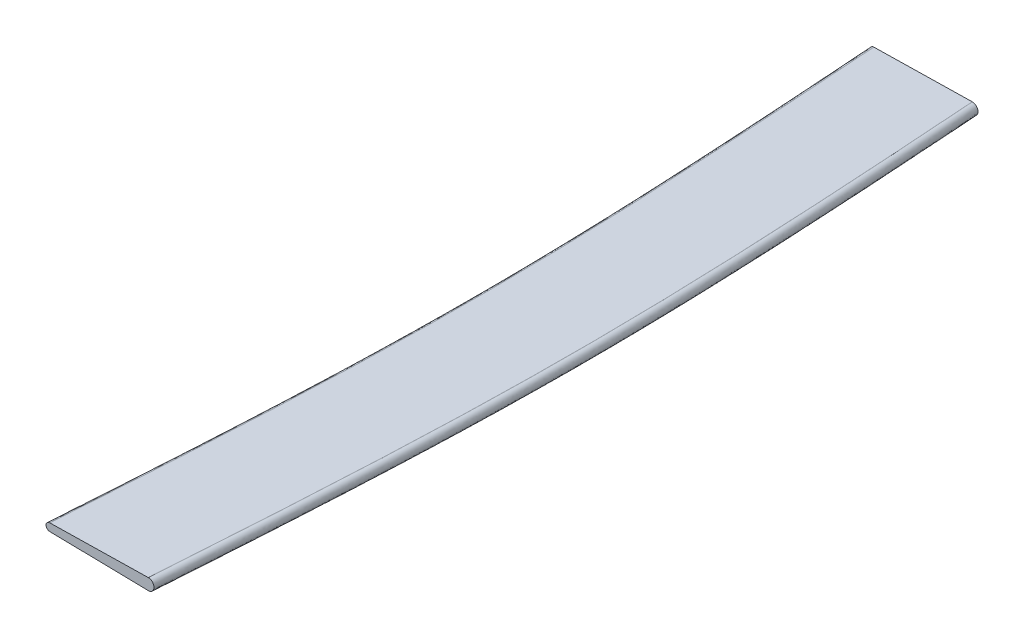
from build123d import *

# Parameters (mm, degrees)
SKETCH3_W          = 147.197168892
SKETCH3_H          = 17.539277342
SKETCH3_W_2        = 144.574061536
SKETCH3_H_2        = 20.253471686
CUT_EXTRUDE1_DEPTH = 35


with BuildPart() as part:
    # Sweep2: sweep along a path in Sketch2
    with BuildLine() as sweep2_path:  # in the path sketch's own coordinates; laid on its plane below (add() does not lay a ready-made edge on the line's plane)
        add(Edge.make_bspline(
            [(-24.41476581, 550), (8.13825527, 84.470109879), (8.13825527, -84.470109879), (-24.41476581, -550)],
            knots=[0, 0, 0, 0, 1, 1, 1, 1], degree=3))
    # Sketch1 → Sweep2 (sweep)
    with BuildSketch(Plane.XY):
        with BuildLine():
            Line((-65, 5), (64.939055745, 7.498827995))
            ThreePointArc((64.939055745, 7.498827995), (65.022313811, 7.499735711), (65.105575448, 7.499256885))
            ThreePointArc((65.105575448, 7.499256885), (72.5, 0), (65.105575448, -7.499256885))
            ThreePointArc((65.105575448, -7.499256885), (65.022313811, -7.499735711), (64.939055745, -7.498827995))
            Line((64.939055745, -7.498827995), (-65, -5))
            ThreePointArc((-65, -5), (-70, 0), (-65, 5))
        make_face()
    sweep(path=Plane(origin=(0, 0, 0), x_dir=(1, 0, 0), z_dir=(0, 1, 0)) * sweep2_path.line)

    # Sketch3 → Cut-Extrude1 (cut, symmetric)
    with BuildSketch(Plane(origin=(0, 0, 0), x_dir=(1, 0, 0), z_dir=(0, 1, 0))):
        with Locations((-20.645664883, 553.886685509)):
            Rectangle(SKETCH3_W, SKETCH3_H)
        with Locations((-21.957218561, -555.243782681)):
            Rectangle(SKETCH3_W_2, SKETCH3_H_2)
    extrude(amount=CUT_EXTRUDE1_DEPTH, both=True, mode=Mode.SUBTRACT)


solid = part.part
